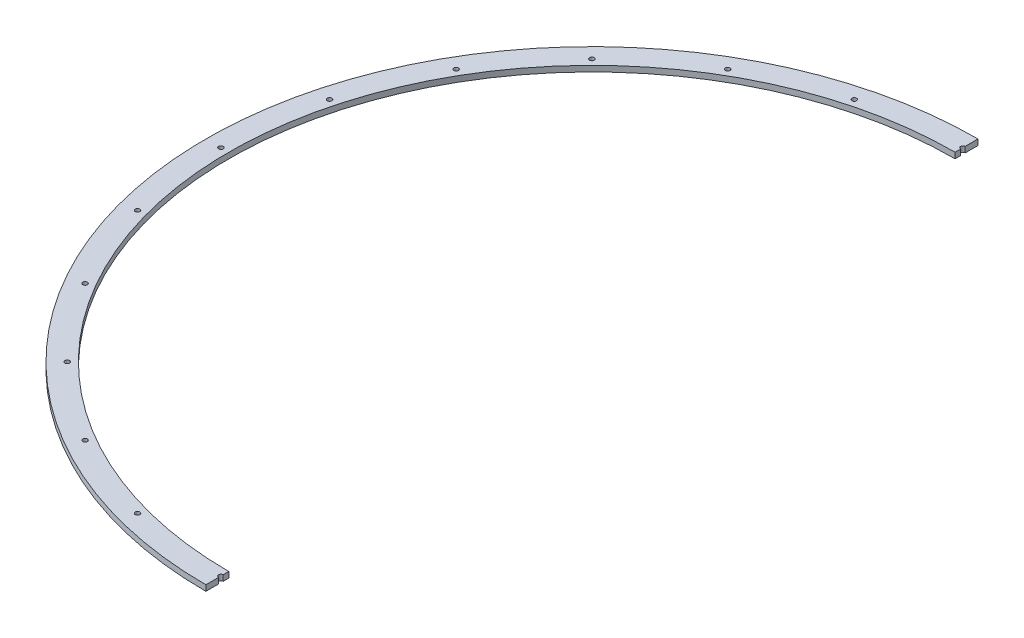
from build123d import *

# Parameters (mm, degrees)
BOSS_EXTRUDE1_START     = -317.5
SKETCH4_R               = 2.54
SKETCH4_R_2             = 9.525
SKETCH4_R_3             = 14.2875
BOSS_EXTRUDE1_DEPTH     = 3.175
BOSS_EXTRUDE2_DEPTH     = 3.175
BOSS_EXTRUDE3_START     = -76.2
BOSS_EXTRUDE3_DEPTH     = 3.175
SKETCH9_R               = 2.54
CUT_EXTRUDE2_DEPTH      = 506.024067921
LPATTERN1_COUNT         = 10
LPATTERN1_PITCH         = 50.8
BOSS_EXTRUDE4_START     = 12.7
SKETCH10_R              = 2.54
BOSS_EXTRUDE4_DEPTH     = 12.7
CUT_EXTRUDE3_START      = -76.2
SKETCH11_W              = 25.4
SKETCH11_H              = 725.706439768
SKETCH11_R              = 2.54
SKETCH11_W_2            = 44.268323152
CUT_EXTRUDE3_DEPTH      = 76.2
SKETCH17_R              = 2.54
CUT_EXTRUDE7_DEPTH      = 641.418199343
CIRPATTERN1_COUNT       = 15
CIRPATTERN1_ANGLE       = 210
BOSS_EXTRUDE6_START     = 25.4
SKETCH18_R              = 482.6
SKETCH18_R_2            = 444.5
BOSS_EXTRUDE6_DEPTH     = 38.1
BOSS_EXTRUDE7_START     = 101.6
BOSS_EXTRUDE7_DEPTH     = 6.35
SKETCH17_2_R            = 2.54
CUT_EXTRUDE8_DEPTH      = 691.983880058
CIRPATTERN2_COUNT       = 15
CIRPATTERN2_ANGLE       = 210
CUT_EXTRUDE9_DEPTH      = 50.8
CUT_EXTRUDE9_DEPTH_BACK = 691.983880058
SKETCH21_R              = 848.891258833
SKETCH25_R              = 608.013624822
CUT_EXTRUDE12_DEPTH     = 127


with BuildPart() as part:
    # Sketch4 → Boss-Extrude1 (new body)
    with BuildSketch(Plane(origin=(0, 0, 0), x_dir=(0, 0, -1), z_dir=(1, 0, 0)).offset(BOSS_EXTRUDE1_START)):
        with BuildLine():
            Line((362.853219884, 88.9), (0, 88.9))
            Line((0, 88.9), (0, 65.0875))
            ThreePointArc((0, 65.0875), (14.2875, 50.8), (0, 36.5125))
            Line((0, 36.5125), (0, 12.7))
            Line((0, 12.7), (362.853219884, 12.7))
            Line((362.853219884, 12.7), (362.853219884, 88.9))
        make_face()
        with Locations((53.34, 25.4)):
            Circle(SKETCH4_R, mode=Mode.SUBTRACT)
        with Locations((53.34, 50.8)):
            Circle(SKETCH4_R_2, mode=Mode.SUBTRACT)
        with Locations((177.45964, 50.8)):
            Circle(SKETCH4_R_3, mode=Mode.SUBTRACT)
        with Locations((53.34, 76.2)):
            Circle(SKETCH4_R, mode=Mode.SUBTRACT)
        with Locations((337.453219884, 53.975)):
            Circle(SKETCH4_R_3, mode=Mode.SUBTRACT)
    extrude(amount=-BOSS_EXTRUDE1_DEPTH)

    # Sketch7 → Boss-Extrude2 (add)
    with BuildSketch(Plane(origin=(0, 88.9, 0), x_dir=(1, 0, 0), z_dir=(0, 1, 0))):
        Polygon((-319.0875, 0), (-342.9, 0), (-342.9, 362.853219884), (-317.5, 362.853219884), align=None)
    extrude(amount=-BOSS_EXTRUDE2_DEPTH)

    # Sketch7<2> → Boss-Extrude3 (add)
    with BuildSketch(Plane(origin=(0, 88.9, 0), x_dir=(1, 0, 0), z_dir=(0, 1, 0)).offset(BOSS_EXTRUDE3_START)):
        Polygon((-319.0875, 0), (-342.9, 0), (-342.9, 362.853219884), (-317.5, 362.853219884), align=None)
    extrude(amount=BOSS_EXTRUDE3_DEPTH)

    # Sketch9 → Cut-Extrude2 (cut, through all)
    with BuildSketch(Plane(origin=(0, 88.9, 0), x_dir=(1, 0, 0), z_dir=(0, 1, 0))):
        with Locations(Location((-330.2, 355.6, 0), (0, 0, 270))):
            Circle(SKETCH9_R)
    cut_extrude2 = extrude(amount=-CUT_EXTRUDE2_DEPTH, mode=Mode.SUBTRACT)

    # LPattern1: Cut-Extrude2 ×10
    with Locations(*[(0, 0, i * LPATTERN1_PITCH) for i in range(1, LPATTERN1_COUNT)]):
        add(cut_extrude2, mode=Mode.SUBTRACT)

    # Mirror1: part across face


with BuildPart() as part_1:
    add(part.part)
    add(part.part.mirror(Plane(origin=(-320.239664948, 22.265914948, 0), x_dir=(1, 0, 0), z_dir=(0, 0, 1))))

    # Sketch10 → Boss-Extrude4 (add)
    with BuildSketch(Plane(origin=(0, 88.9, 0), x_dir=(1, 0, 0), z_dir=(0, 1, 0)).offset(BOSS_EXTRUDE4_START)):
        with BuildLine():
            Line((0, -452.755), (0, 452.755))
            ThreePointArc((0, 452.755), (-233.269031744, 388.03691687), (-399.849790193, 212.38464))
            Line((-399.849790193, 212.38464), (-381, 212.38464))
            Line((-381, 212.38464), (-381, 142.53464))
            Line((-381, 142.53464), (-419.1, 142.53464))
            Line((-419.1, 142.53464), (-419.1, 171.295884437))
            ThreePointArc((-419.1, 171.295884437), (-452.755, 0), (-419.1, -171.295884437))
            Line((-419.1, -171.295884437), (-419.1, -142.53464))
            Line((-419.1, -142.53464), (-381, -142.53464))
            Line((-381, -142.53464), (-381, -212.38464))
            Line((-381, -212.38464), (-399.849790193, -212.38464))
            ThreePointArc((-399.849790193, -212.38464), (-356.378451147, -279.251659947), (-301.848330151, -337.453219884))
            ThreePointArc((-301.848330151, -337.453219884), (-161.560294405, -422.948414463), (0, -452.755))
        make_face()
        with Locations(Location((-330.2, -304.8, 0), (0, 0, 90))):
            Circle(SKETCH10_R, mode=Mode.SUBTRACT)
        with Locations(Location((-330.2, -254, 0), (0, 0, 90))):
            Circle(SKETCH10_R, mode=Mode.SUBTRACT)
        with Locations(Location((-330.2, -203.2, 0), (0, 0, 90))):
            Circle(SKETCH10_R, mode=Mode.SUBTRACT)
        with Locations(Location((-330.2, -152.4, 0), (0, 0, 90))):
            Circle(SKETCH10_R, mode=Mode.SUBTRACT)
        with Locations(Location((-330.2, -101.6, 0), (0, 0, 90))):
            Circle(SKETCH10_R, mode=Mode.SUBTRACT)
        with Locations(Location((-330.2, -50.8, 0), (0, 0, 90))):
            Circle(SKETCH10_R, mode=Mode.SUBTRACT)
        with Locations(Location((-330.2, 0, 0), (0, 0, 270))):
            Circle(SKETCH10_R, mode=Mode.SUBTRACT)
        with Locations(Location((-330.2, 50.8, 0), (0, 0, 270))):
            Circle(SKETCH10_R, mode=Mode.SUBTRACT)
        with Locations(Location((-330.2, 101.6, 0), (0, 0, 270))):
            Circle(SKETCH10_R, mode=Mode.SUBTRACT)
        with Locations(Location((-330.2, 152.4, 0), (0, 0, 270))):
            Circle(SKETCH10_R, mode=Mode.SUBTRACT)
        with Locations(Location((-330.2, 203.2, 0), (0, 0, 270))):
            Circle(SKETCH10_R, mode=Mode.SUBTRACT)
        with Locations(Location((-330.2, 254, 0), (0, 0, 270))):
            Circle(SKETCH10_R, mode=Mode.SUBTRACT)
        with Locations(Location((-330.2, 304.8, 0), (0, 0, 270))):
            Circle(SKETCH10_R, mode=Mode.SUBTRACT)
        with Locations(Location((-441.325, 88.9, 0), (0, 0, 270))):
            Circle(SKETCH10_R, mode=Mode.SUBTRACT)
        with Locations(Location((-441.325, 0, 0), (0, 0, 270))):
            Circle(SKETCH10_R, mode=Mode.SUBTRACT)
        with Locations(Location((-441.325, -88.9, 0), (0, 0, 270))):
            Circle(SKETCH10_R, mode=Mode.SUBTRACT)
    extrude(amount=-BOSS_EXTRUDE4_DEPTH)

    # Sketch11 → Cut-Extrude3 (cut)
    # profile 1 of 2: a face of its own
    with BuildSketch(Plane.XZ.offset(-12.7).offset(CUT_EXTRUDE3_START)):
        with Locations((-330.2, 0)):
            Rectangle(SKETCH11_W, SKETCH11_H)
        with Locations(Location((-330.2, -203.2, 0), (0, 0, 90))):
            Circle(SKETCH11_R, mode=Mode.SUBTRACT)
        with Locations(Location((-330.2, -101.6, 0), (0, 0, 90))):
            Circle(SKETCH11_R, mode=Mode.SUBTRACT)
        with Locations(Location((-330.2, -304.8, 0), (0, 0, 90))):
            Circle(SKETCH11_R, mode=Mode.SUBTRACT)
        with Locations(Location((-330.2, 203.2, 0), (0, 0, 270))):
            Circle(SKETCH11_R, mode=Mode.SUBTRACT)
        with Locations(Location((-330.2, 101.6, 0), (0, 0, 90))):
            Circle(SKETCH11_R, mode=Mode.SUBTRACT)
        with Locations(Location((-330.2, 304.8, 0), (0, 0, 270))):
            Circle(SKETCH11_R, mode=Mode.SUBTRACT)
        with Locations((-330.2, 355.6)):
            Circle(SKETCH11_R, mode=Mode.SUBTRACT)
        with Locations(Location((-330.2, 50.8, 0), (0, 0, 90))):
            Circle(SKETCH11_R, mode=Mode.SUBTRACT)
        with Locations(Location((-330.2, 152.4, 0), (0, 0, 90))):
            Circle(SKETCH11_R, mode=Mode.SUBTRACT)
        with Locations(Location((-330.2, 254, 0), (0, 0, 270))):
            Circle(SKETCH11_R, mode=Mode.SUBTRACT)
        with Locations((-330.2, -355.6)):
            Circle(SKETCH11_R, mode=Mode.SUBTRACT)
        with Locations(Location((-330.2, -50.8, 0), (0, 0, 90))):
            Circle(SKETCH11_R, mode=Mode.SUBTRACT)
        with Locations(Location((-330.2, -152.4, 0), (0, 0, 90))):
            Circle(SKETCH11_R, mode=Mode.SUBTRACT)
        with Locations(Location((-330.2, -254, 0), (0, 0, 90))):
            Circle(SKETCH11_R, mode=Mode.SUBTRACT)
    # profile 2 of 2: a face of its own
    with BuildSketch(Plane.XZ.offset(-12.7).offset(CUT_EXTRUDE3_START)):
        with Locations((-365.034161576, 0)):
            Rectangle(SKETCH11_W_2, SKETCH11_H)
    extrude(amount=CUT_EXTRUDE3_DEPTH, mode=Mode.SUBTRACT)

    # Sketch17 → Cut-Extrude7 (cut, through all)
    with BuildSketch(Plane(origin=(0, 101.6, 0), x_dir=(1, 0, 0), z_dir=(0, 1, 0))):
        with Locations((0, -410.68625)):
            Circle(SKETCH17_R)
    cut_extrude7 = extrude(amount=-CUT_EXTRUDE7_DEPTH, mode=Mode.SUBTRACT)

    # CirPattern1: Cut-Extrude7 ×15 about axis
    cirpattern1_axis = Axis((0, 0, 0), (0, -1, 0))
    for i in range(1, CIRPATTERN1_COUNT):
        add(cut_extrude7.rotate(cirpattern1_axis, i * CIRPATTERN1_ANGLE / (CIRPATTERN1_COUNT - 1)), mode=Mode.SUBTRACT)

    # Sketch21 → Cut-Extrude9 (cut, two sides: drawn at the far end of the back side and taken through both)
    with BuildSketch(Plane(origin=(0, 101.6, 0), x_dir=(1, 0, 0), z_dir=(0, 1, 0)).offset(-CUT_EXTRUDE9_DEPTH_BACK)):
        Circle(SKETCH21_R)
    extrude(amount=CUT_EXTRUDE9_DEPTH + CUT_EXTRUDE9_DEPTH_BACK, mode=Mode.SUBTRACT)


with BuildPart() as body_2:
    # Sketch18 → Boss-Extrude6 (new body)
    with BuildSketch(Plane(origin=(0, 101.6, 0), x_dir=(1, 0, 0), z_dir=(0, 1, 0)).offset(BOSS_EXTRUDE6_START)):
        with Locations(Location((0, 0, 0), (0, 0, 90))):
            Circle(SKETCH18_R)
        with Locations(Location((0, 0, 0), (0, 0, 90))):
            Circle(SKETCH18_R_2, mode=Mode.SUBTRACT)
    extrude(amount=BOSS_EXTRUDE6_DEPTH)

    # Sketch25 → Cut-Extrude12 (cut)
    with BuildSketch(Plane(origin=(0, 165.1, 0), x_dir=(1, 0, 0), z_dir=(0, 1, 0))):
        Circle(SKETCH25_R)
    extrude(amount=-CUT_EXTRUDE12_DEPTH, mode=Mode.SUBTRACT)


with BuildPart() as body_3:
    # Sketch19 → Boss-Extrude7 (new body)
    with BuildSketch(Plane(origin=(0, 101.6, 0), x_dir=(1, 0, 0), z_dir=(0, 1, 0)).offset(BOSS_EXTRUDE7_START)):
        with BuildLine():
            Line((0, -427.355), (0, -401.955))
            ThreePointArc((0, -401.955), (-401.955, 0), (0, 401.955))
            Line((0, 401.955), (0, 427.355))
            ThreePointArc((0, 427.355), (-427.355, 0), (0, -427.355))
        make_face()
    extrude(amount=BOSS_EXTRUDE7_DEPTH)

    # Sketch17<2> → Cut-Extrude8 (cut, through all)
    with BuildSketch(Plane(origin=(0, 101.6, 0), x_dir=(1, 0, 0), z_dir=(0, 1, 0))):
        with Locations((0, -410.68625)):
            Circle(SKETCH17_2_R)
    cut_extrude8 = extrude(amount=CUT_EXTRUDE8_DEPTH, mode=Mode.SUBTRACT)

    # CirPattern2: Cut-Extrude8 ×15 about axis
    cirpattern2_axis = Axis((0, 0, 0), (0, -1, 0))
    for i in range(1, CIRPATTERN2_COUNT):
        add(cut_extrude8.rotate(cirpattern2_axis, i * CIRPATTERN2_ANGLE / (CIRPATTERN2_COUNT - 1)), mode=Mode.SUBTRACT)


solid = body_3.part
